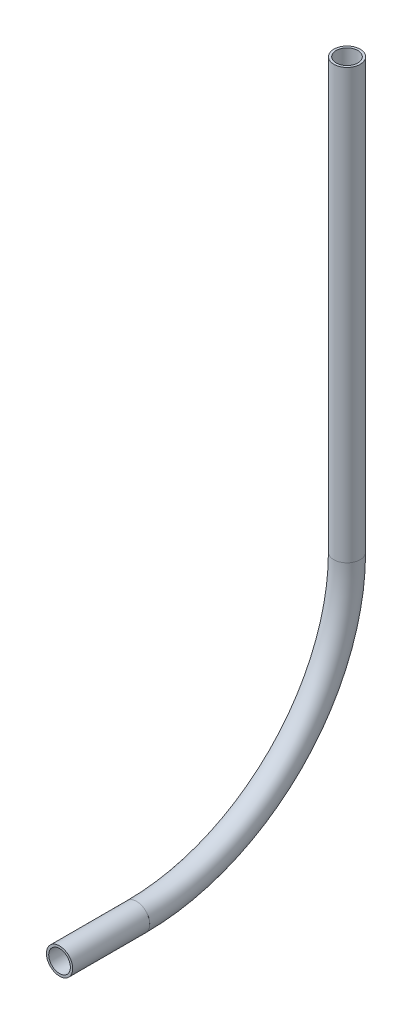
from build123d import *

# Parameters (mm, degrees)
SKETCH11_R                = 3.175
SKETCH11_R_2              = 2.6162
PIPE_0_5_SCH_40_1_DEPTH   = 18.607204999
SKETCH11_ON_SEGMENT_2_R   = 3.175
SKETCH11_ON_SEGMENT_2_R_2 = 2.6162
PIPE_0_5_SCH_40_1_2_ANGLE = 90
SKETCH11_ON_SEGMENT_3_R   = 3.175
SKETCH11_ON_SEGMENT_3_R_2 = 2.6162
PIPE_0_5_SCH_40_1_3_DEPTH = 103.594068945


with BuildPart() as part:
    # Sketch11 → Pipe 0.5 SCH 40(1) (new body)
    with BuildSketch(Plane(origin=(0, 598.064549316, 303.164595711), x_dir=(0, 1, 0), z_dir=(0, 0, -1))):
        Circle(SKETCH11_R)
        Circle(SKETCH11_R_2, mode=Mode.SUBTRACT)
    extrude(amount=PIPE_0_5_SCH_40_1_DEPTH)


with BuildPart() as body_2:
    # Sketch11 on segment 2 (carried to the start of arc 2) → Pipe 0.5 SCH 40_1 2 (revolve)
    with BuildSketch(Plane(origin=(0, 598.064549316, 284.557390712), x_dir=(0, 1, 0), z_dir=(0, 0, -1))):
        Circle(SKETCH11_ON_SEGMENT_2_R)
        Circle(SKETCH11_ON_SEGMENT_2_R_2, mode=Mode.SUBTRACT)
    revolve(axis=Axis((0, 648.864549316, 284.557390712), (1, 0, 0)), revolution_arc=PIPE_0_5_SCH_40_1_2_ANGLE)


with BuildPart() as body_3:
    # Sketch11 on segment 3 (carried to segment 3) → Pipe 0.5 SCH 40_1 3 (new body)
    with BuildSketch(Plane(origin=(0, 648.864549316, 233.757390712), x_dir=(0, 0, 1), z_dir=(0, 1, 0))):
        Circle(SKETCH11_ON_SEGMENT_3_R)
        Circle(SKETCH11_ON_SEGMENT_3_R_2, mode=Mode.SUBTRACT)
    extrude(amount=PIPE_0_5_SCH_40_1_3_DEPTH)


solid = Compound([part.part, body_2.part, body_3.part])
